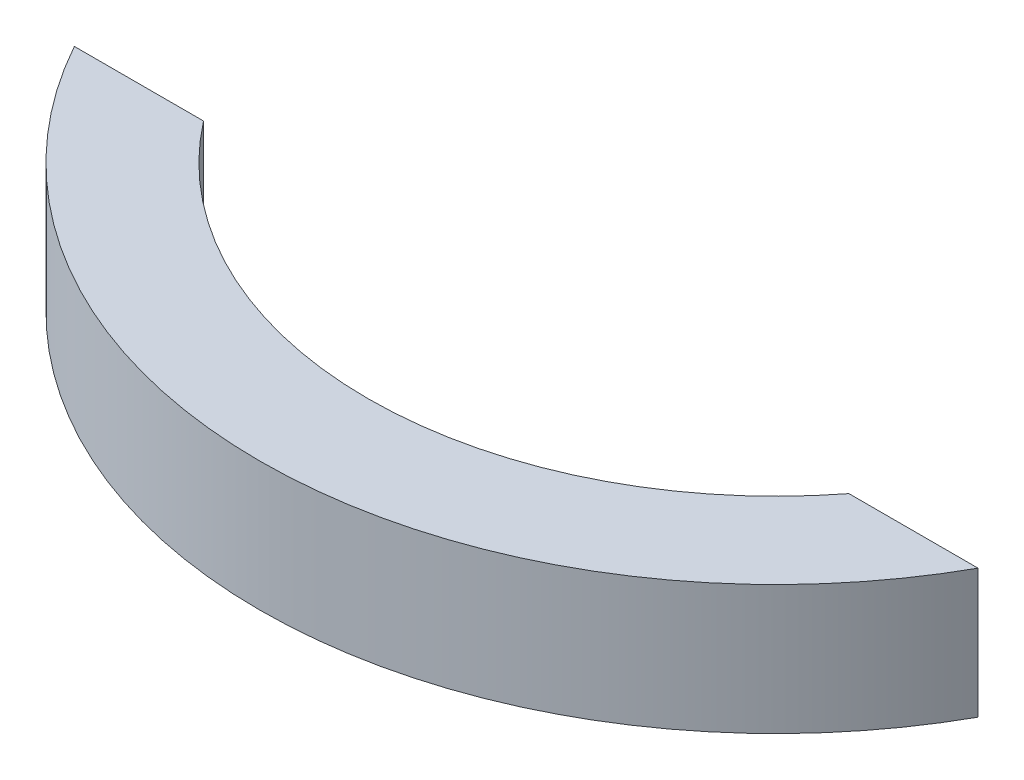
from build123d import *

# Parameters (mm, degrees)
BOSS_EXTRUDE1_DEPTH = 5


with BuildPart() as part:
    # Sketch1 → Boss-Extrude1 (new body)
    with BuildSketch(Plane(origin=(0, 0, 0), x_dir=(1, 0, 0), z_dir=(0, 1, 0))):
        with BuildLine():
            Line((-17.5, 5.317541634), (-12.5, 5.317541634))
            ThreePointArc((-12.5, 5.317541634), (0, -0.811388301), (12.5, 5.317541634))
            Line((12.5, 5.317541634), (17.5, 5.317541634))
            ThreePointArc((17.5, 5.317541634), (0, -5), (-17.5, 5.317541634))
        make_face()
    extrude(amount=BOSS_EXTRUDE1_DEPTH)


solid = part.part
